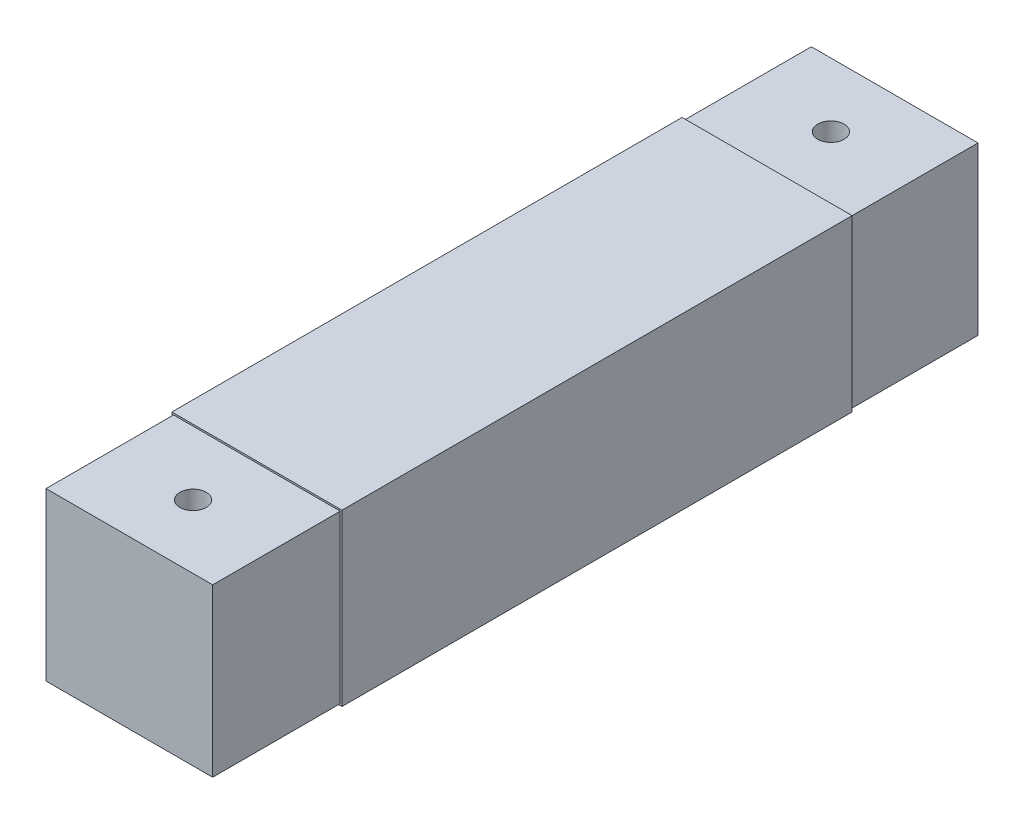
from build123d import *

# Parameters (mm, degrees)
SKETCH_1_W          = 20
SKETCH_1_H          = 20
EXTRUDE_1_DEPTH     = 120
SKETCH_2_W          = 10
SKETCH_2_H          = 20
CUT_EXTRUDE_1_DEPTH = 120
CUT_EXTRUDE_2_DEPTH = 120
SKETCH_4_R          = 3
CUT_EXTRUDE_3_DEPTH = 2
SKETCH_8_W          = 19.6
SKETCH_8_H          = 0.2
SKETCH_8_W_2        = 0.2
SKETCH_8_H_2        = 19.6
CUT_EXTRUDE_6_DEPTH = 15
SKETCH_9_W          = 10
SKETCH_9_H          = 20
CUT_EXTRUDE_7_DEPTH = 20
SKETCH_10_W         = 19.6
SKETCH_10_H         = 19.6
EXTRUDE_2_DEPTH     = 15
CUT_EXTRUDE_8_DEPTH = 20
CUT_EXTRUDE_9_DEPTH = 20


with BuildPart() as part:
    # 草图1 → 凸台-拉伸1 (new body)
    with BuildSketch(Plane.XY):
        with Locations((10, 10)):
            Rectangle(SKETCH_1_W, SKETCH_1_H)
    extrude(amount=EXTRUDE_1_DEPTH)

    # 草图2 → 切除-拉伸1 (cut)
    with BuildSketch(Plane(origin=(0, 20, 0), x_dir=(1, 0, 0), z_dir=(0, 1, 0))):
        with Locations((15, -10)):
            Rectangle(SKETCH_2_W, SKETCH_2_H)
    extrude(amount=-CUT_EXTRUDE_1_DEPTH, mode=Mode.SUBTRACT)

    # 草图3 → 切除-拉伸2 (cut)
    with BuildSketch(Plane(origin=(10, 0, 0), x_dir=(0, 0, -1), z_dir=(1, 0, 0))):
        with BuildLine():
            ThreePointArc((-8.45, 10), (-9.40684068, 11.432013275), (-11.096015511, 11.096015511))
            Line((-11.096015511, 11.096015511), (-8.903984489, 8.903984489))
            ThreePointArc((-8.903984489, 8.903984489), (-8.567986725, 9.40684068), (-8.45, 10))
        make_face()
        with BuildLine():
            Line((-8.903984489, 8.903984489), (-11.096015511, 11.096015511))
            ThreePointArc((-11.096015511, 11.096015511), (-11.096015511, 8.903984489), (-8.903984489, 8.903984489))
        make_face()
    extrude(amount=-CUT_EXTRUDE_2_DEPTH, mode=Mode.SUBTRACT)

    # 草图4 → 切除-拉伸3 (cut)
    with BuildSketch(Plane.ZY):
        with Locations((10, 10)):
            Circle(SKETCH_4_R)
    extrude(amount=-CUT_EXTRUDE_3_DEPTH, mode=Mode.SUBTRACT)

    # 草图8 → 切除-拉伸6 (cut)
    with BuildSketch(Plane.XY.offset(120)):
        with Locations((10, 19.9)):
            Rectangle(SKETCH_8_W, SKETCH_8_H)
        with Locations((0.1, 19.9)):
            Rectangle(SKETCH_8_W_2, SKETCH_8_H)
        with Locations((0.1, 10)):
            Rectangle(SKETCH_8_W_2, SKETCH_8_H_2)
        with Locations((19.9, 10)):
            Rectangle(SKETCH_8_W_2, SKETCH_8_H_2)
        with Locations((19.9, 0.1)):
            Rectangle(SKETCH_8_W_2, SKETCH_8_H)
        with Locations((10, 0.1)):
            Rectangle(SKETCH_8_W, SKETCH_8_H)
        with Locations((0.1, 0.1)):
            Rectangle(SKETCH_8_W_2, SKETCH_8_H)
        with Locations((19.9, 19.9)):
            Rectangle(SKETCH_8_W_2, SKETCH_8_H)
    extrude(amount=-CUT_EXTRUDE_6_DEPTH, mode=Mode.SUBTRACT)

    # 草图9 → 切除-拉伸7 (cut)
    with BuildSketch(Plane(origin=(0, 20, 0), x_dir=(1, 0, 0), z_dir=(0, 1, 0))):
        Polygon((0, 0), (0, -45), (20, -45), (20, -20), (10, -20), (10, 0), align=None)
        with Locations((15, -10)):
            Rectangle(SKETCH_9_W, SKETCH_9_H)
    extrude(amount=-CUT_EXTRUDE_7_DEPTH, mode=Mode.SUBTRACT)

    # 草图10 → 凸台-拉伸2 (add)
    with BuildSketch(Plane(origin=(0, 0, 45), x_dir=(-1, 0, 0), z_dir=(0, 0, -1))):
        with Locations((-10, 10)):
            Rectangle(SKETCH_10_W, SKETCH_10_H)
    extrude(amount=EXTRUDE_2_DEPTH)

    # 草图11 → 切除-拉伸8 (cut)
    with BuildSketch(Plane(origin=(0, 19.8, 0), x_dir=(1, 0, 0), z_dir=(0, 1, 0))):
        with BuildLine():
            ThreePointArc((11.547573501, -112.5), (10.487812185, -111.029569439), (8.757681845, -111.569855559))
            Line((8.757681845, -111.569855559), (11.237465157, -113.430144441))
            ThreePointArc((11.237465157, -113.430144441), (11.468004062, -112.990238683), (11.547573501, -112.5))
        make_face()
        with BuildLine():
            Line((11.237465157, -113.430144441), (8.757681845, -111.569855559))
            ThreePointArc((8.757681845, -111.569855559), (9.06742906, -113.739891656), (11.237465157, -113.430144441))
        make_face()
    extrude(amount=-CUT_EXTRUDE_8_DEPTH, mode=Mode.SUBTRACT)

    # 草图12 → 切除-拉伸9 (cut)
    with BuildSketch(Plane(origin=(0, 19.8, 0), x_dir=(1, 0, 0), z_dir=(0, 1, 0))):
        with BuildLine():
            ThreePointArc((11.55, -37.5), (10.490153037, -36.029540888), (8.76, -36.57))
            Line((8.76, -36.57), (11.24, -38.43))
            ThreePointArc((11.24, -38.43), (11.470459112, -37.990153037), (11.55, -37.5))
        make_face()
        with BuildLine():
            Line((11.24, -38.43), (8.76, -36.57))
            ThreePointArc((8.76, -36.57), (9.07, -38.74), (11.24, -38.43))
        make_face()
    extrude(amount=-CUT_EXTRUDE_9_DEPTH, mode=Mode.SUBTRACT)


solid = part.part
